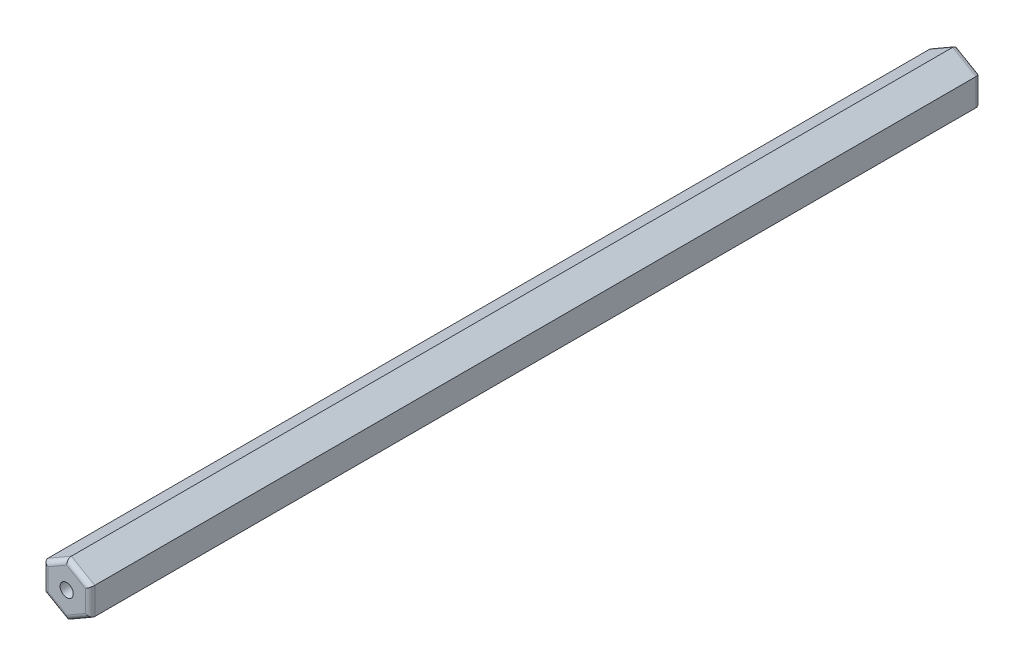
from build123d import *

# Parameters (mm, degrees)
RESSALTO_EXTRUS_O1_DEPTH = 95
FILETE1_R                = 0.5
ESBO_O2_R                = 0.701481341
CORTE_EXTRUS_O1_DEPTH    = 112.084775939


with BuildPart() as part:
    # Esboço1 → Ressalto-extrusão1 (new body)
    with BuildSketch(Plane.XY.offset(135)):
        Polygon((-55.002122675, 2.886751346), (-57.502122675, 1.443375673), (-57.502122675, -1.443375673), (-55.002122675, -2.886751346), (-52.502122675, -1.443375673), (-52.502122675, 1.443375673), align=None)
    extrude(amount=-RESSALTO_EXTRUS_O1_DEPTH)

    # Filete1
    filete1_edges = [part.edges().sort_by_distance(p)[0] for p in [
        (-57.502122675, 0, 40),
        (-56.252122675, -2.165063509, 40),
        (-53.752122675, -2.165063509, 40),
        (-52.502122675, 0, 40),
        (-53.752122675, 2.165063509, 40),
        (-52.502122675, 0, 135),
        (-53.752122675, -2.165063509, 135),
        (-56.252122675, -2.165063509, 135),
        (-57.502122675, 0, 135),
        (-56.252122675, 2.165063509, 135),
        (-53.752122675, 2.165063509, 135),
        (-56.252122675, 2.165063509, 40),
    ]]
    fillet(filete1_edges, radius=FILETE1_R)

    # Esboço2 → Corte-extrusão1 (cut, through all)
    with BuildSketch(Plane.XY.offset(135)):
        with Locations((-55.002122675, 0)):
            Circle(ESBO_O2_R)
    extrude(amount=-CORTE_EXTRUS_O1_DEPTH, mode=Mode.SUBTRACT)


solid = part.part
